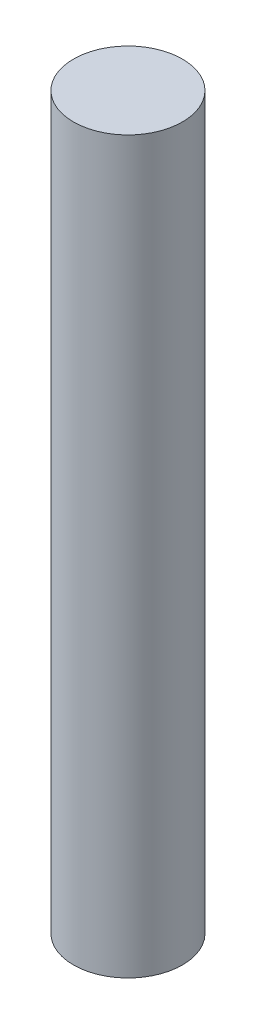
from build123d import *

# Parameters (mm, degrees)
SKETCH1_R           = 3.175
BOSS_EXTRUDE1_DEPTH = 42.545


with BuildPart() as part:
    # Sketch1 → Boss-Extrude1 (new body)
    with BuildSketch(Plane(origin=(0, 0, 0), x_dir=(1, 0, 0), z_dir=(0, 1, 0))):
        with Locations(Location((0, 0, 0), (0, 0, 270))):
            Circle(SKETCH1_R)
    extrude(amount=BOSS_EXTRUDE1_DEPTH)


solid = part.part
